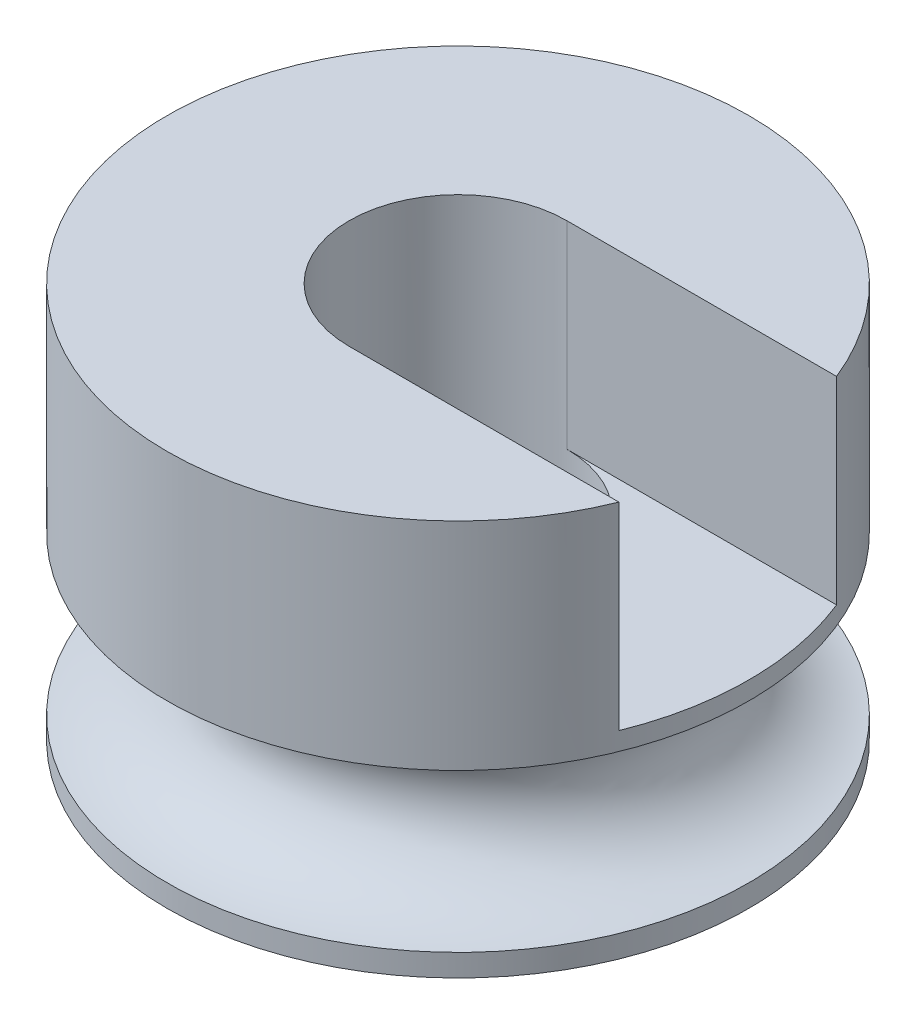
from build123d import *
from build123d.topology import SkipClean

# Parameters (mm, degrees)
SKETCH1_R               = 7.35
BOSS_EXTRUDE1_DEPTH     = 10
CUT_EXTRUDE1_DEPTH      = 5
CUT_EXTRUDE2_DEPTH      = 15.423765112
CUT_EXTRUDE2_DEPTH_BACK = 15.423765112
SKETCH3_R               = 2.75
SKETCH4_RX              = 2.5
SKETCH4_RY              = 2


with BuildPart() as part:
    # Sketch1 → Boss-Extrude1 (new body)
    with BuildSketch(Plane(origin=(0, 0, 0), x_dir=(1, 0, 0), z_dir=(0, 1, 0))):
        with Locations(Location((0, 0, 0), (0, 0, 270))):
            Circle(SKETCH1_R)
    extrude(amount=BOSS_EXTRUDE1_DEPTH)

    # Sketch2 → Cut-Extrude1 (cut)
    with BuildSketch(Plane(origin=(0, 10, 0), x_dir=(1, 0, 0), z_dir=(0, 1, 0))):
        with BuildLine():
            Line((0, 2.75), (9.425049625, 2.75))
            Line((9.425049625, 2.75), (9.711324497, -2.75))
            Line((9.711324497, -2.75), (0, -2.75))
            ThreePointArc((0, -2.75), (-2.75, 0), (0, 2.75))
        make_face()
    extrude(amount=-CUT_EXTRUDE1_DEPTH, mode=Mode.SUBTRACT)

    # Sketch3 → Cut-Extrude2 (cut, two sides: drawn at the far end of the back side and taken through both)
    with BuildSketch(Plane(origin=(0, 10, 0), x_dir=(1, 0, 0), z_dir=(0, 1, 0)).offset(-CUT_EXTRUDE2_DEPTH_BACK)):
        with Locations(Location((0, 0, 0), (0, 0, 270))):
            Circle(SKETCH3_R)
    extrude(amount=CUT_EXTRUDE2_DEPTH + CUT_EXTRUDE2_DEPTH_BACK, mode=Mode.SUBTRACT)

    # Sketch4 → Cut-Revolve1 (revolve, cut)
    with SkipClean():  # the faces are left unmerged after this step: merging them gives an invalid solid
        with BuildSketch(Plane.XY, mode=Mode.PRIVATE) as cut_revolve1_sk:
            with Locations((-7.59796792, 2.550632184)):
                Ellipse(SKETCH4_RX, SKETCH4_RY)
        revolve(cut_revolve1_sk.sketch.rotate(Axis((0, 10, 0), (0, 1, 0)), 270), axis=Axis((0, 10, 0), (0, 1, 0)), mode=Mode.SUBTRACT)


solid = part.part
